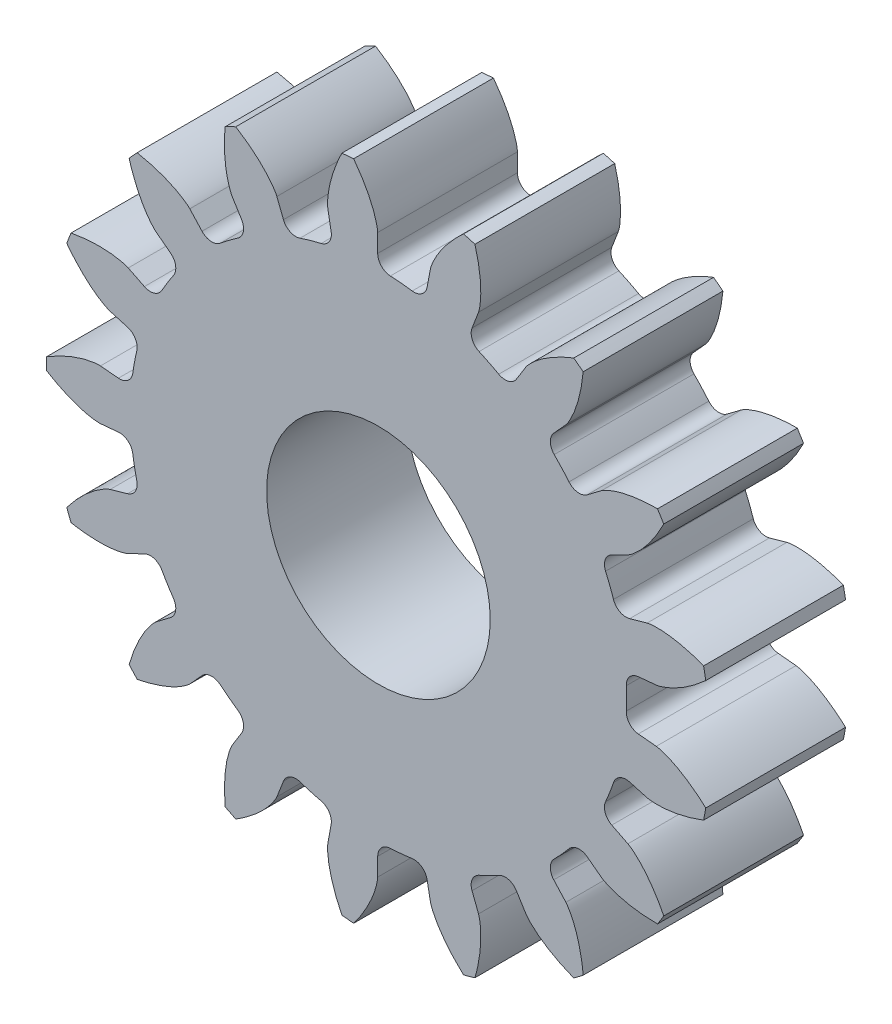
from build123d import *

# Parameters (mm, degrees)
BLANK_SKETCH_R    = 11.875
BLANK_DEPTH       = 5
TOOTH_SPACE_DEPTH = 18.522307211
TEETH_COUNT       = 17
BORE_DEPTH        = 18.499960093
BORE_DEPTH_BACK   = 18.499960093
BORE_SKETCH_R     = 4


with BuildPart() as part:
    # Blank Sketch → Blank (new body)
    with BuildSketch(Plane.XY):
        Circle(BLANK_SKETCH_R)
    extrude(amount=BLANK_DEPTH)

    # Tooth Space Sketch → Tooth Space (cut, symmetric)
    with BuildSketch(Plane.XY):
        with BuildLine():
            Line((9.939079093, 0.948492097), (9.295694704, 0.887093551))
            ThreePointArc((9.295694704, 0.887093551), (8.98235795, 0.725899492), (8.866285625, 0.393197431))
            ThreePointArc((8.866285625, 0.393197431), (8.875, 0), (8.866285625, -0.393197431))
            ThreePointArc((8.866285625, -0.393197431), (8.98235795, -0.725899492), (9.295694704, -0.887093551))
            Line((9.295694704, -0.887093551), (9.939079093, -0.948492097))
            add(Edge.make_bspline(
                [(9.939079093, -0.948492097), (9.944419956, -0.949099255), (9.959363538, -0.951100483), (9.987461284, -0.956060515), (10.033024977, -0.965815194), (10.090612537, -0.980674949), (10.164414462, -1.002652043), (10.250457009, -1.032080202), (10.343964765, -1.068095975), (10.444451681, -1.11120542), (10.543514859, -1.15765376), (10.641151163, -1.207155784), (10.737293163, -1.259303994), (10.852346672, -1.325781398), (10.988299107, -1.410072048), (11.14406597, -1.515140112), (11.316856551, -1.641938971), (11.488524989, -1.779131562), (11.653706097, -1.920614485), (11.816027404, -2.070803406), (11.969819819, -2.2212394), (12.124556639, -2.38463298), (12.26486155, -2.539111634), (12.416223734, -2.71980126), (12.536695511, -2.867871874), (12.656096039, -3.026982739), (12.713455505, -3.105320734), (12.742448933, -3.145730469)],
                knots=[0, 0, 0, 0, 0, 0.005376748, 0.015083688, 0.02853182, 0.046610139, 0.064854849, 0.092110525, 0.119476176, 0.146842495, 0.174208854, 0.201574955, 0.228941013, 0.256307345, 0.307035032, 0.361767351, 0.41649966, 0.471231936, 0.525964282, 0.580696615, 0.635428982, 0.690161387, 0.744893688, 0.799626082, 0.854358408, 0.909090915, 0.909090915, 0.909090915, 0.909090915, 0.909090915], degree=4))
            Line((12.742448933, -3.145730469), (12.742448933, 3.145730469))
            add(Edge.make_bspline(
                [(9.939079093, 0.948492097), (9.944419956, 0.949099255), (9.959363538, 0.951100483), (9.987461284, 0.956060515), (10.033024977, 0.965815194), (10.090612537, 0.980674949), (10.164414462, 1.002652043), (10.250457009, 1.032080202), (10.343964765, 1.068095975), (10.444451681, 1.11120542), (10.543514859, 1.15765376), (10.641151163, 1.207155784), (10.737293163, 1.259303994), (10.852346672, 1.325781398), (10.988299107, 1.410072048), (11.14406597, 1.515140112), (11.316856551, 1.641938971), (11.488524989, 1.779131562), (11.653706097, 1.920614485), (11.816027404, 2.070803406), (11.969819819, 2.2212394), (12.124556639, 2.38463298), (12.26486155, 2.539111634), (12.416223734, 2.71980126), (12.536695511, 2.867871874), (12.656096039, 3.026982739), (12.713455505, 3.105320734), (12.742448933, 3.145730469)],
                knots=[0, 0, 0, 0, 0, 0.005376748, 0.015083688, 0.02853182, 0.046610139, 0.064854849, 0.092110525, 0.119476176, 0.146842495, 0.174208854, 0.201574955, 0.228941013, 0.256307345, 0.307035032, 0.361767351, 0.41649966, 0.471231936, 0.525964282, 0.580696615, 0.635428982, 0.690161387, 0.744893688, 0.799626082, 0.854358408, 0.909090915, 0.909090915, 0.909090915, 0.909090915, 0.909090915], degree=4))
        make_face()
    tooth_space = extrude(amount=TOOTH_SPACE_DEPTH, both=True, mode=Mode.SUBTRACT)

    # Teeth: Tooth Space ×17 about axis
    teeth_axis = Axis((0, 0, -0.25007105), (0, 0, 1))
    for i in range(1, TEETH_COUNT):
        add(tooth_space.rotate(teeth_axis, i * 360 / TEETH_COUNT), mode=Mode.SUBTRACT)

    # Bore Sketch → Bore (cut, two sides: drawn at the far end of the back side and taken through both)
    with BuildSketch(Plane.XY.offset(-BORE_DEPTH_BACK)):
        Circle(BORE_SKETCH_R)
    extrude(amount=BORE_DEPTH + BORE_DEPTH_BACK, mode=Mode.SUBTRACT)


solid = part.part
